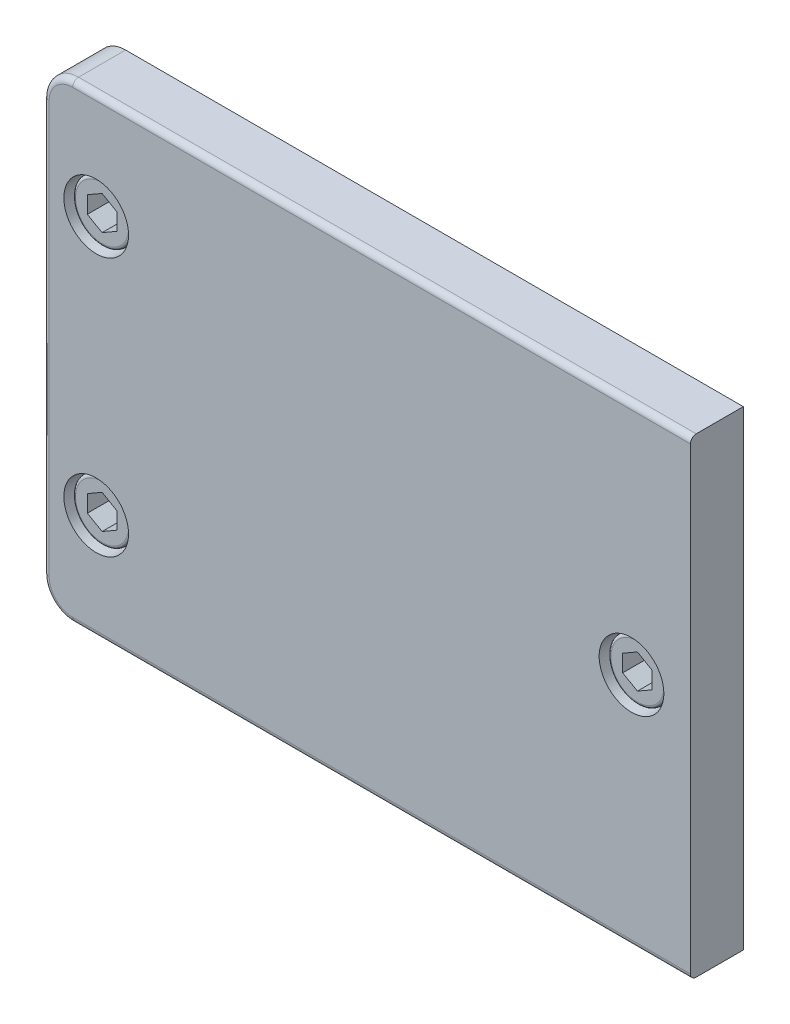
from build123d import *

# Parameters (mm, degrees)
BOSS_EXTRU_1_DEPTH               = 9
CONG_1_R                         = 1
ESQUISSE4_R                      = 5.5
ENL_V_MAT_EXTRU_1_DEPTH          = 7
ESQUISSE5_R                      = 5
BOSS_EXTRU_2_DEPTH               = 6
CONG_2_R                         = 0.5
ENL_V_MAT_EXTRU_2_DEPTH          = 4
R_P_TITION_LIN_AIRE1_COUNT       = 2
R_P_TITION_LIN_AIRE1_PITCH       = 44
CONG_2_OF_R_P_TITION_LIN_AIRE1_R = 0.5
ESQUISSE7_R                      = 5.5
ENL_V_MAT_EXTRU_3_DEPTH          = 7
ESQUISSE8_R                      = 5
BOSS_EXTRU_3_DEPTH               = 6
CONG_3_R                         = 0.5
ENL_V_MAT_EXTRU_4_DEPTH          = 5
ESQUISSE10_R                     = 3
ENL_V_MAT_EXTRU_5_DEPTH          = 5


with BuildPart() as part:
    # Esquisse1 → Boss.-Extru.1 (new body)
    with BuildSketch(Plane(origin=(0, 0, 0), x_dir=(-1, 0, 0), z_dir=(0, 0, 1))):
        with BuildLine():
            Line((0, 5), (0, 75))
            ThreePointArc((0, 75), (-1.464466094, 78.535533906), (-5, 80))
            Line((-5, 80), (-110, 80))
            Line((-110, 80), (-110, 0))
            Line((-110, 0), (-5, 0))
            ThreePointArc((-5, 0), (-1.464466094, 1.464466094), (0, 5))
        make_face()
    extrude(amount=BOSS_EXTRU_1_DEPTH)

    # Congé1
    cong_1_edges = [part.edges().sort_by_distance(p)[0] for p in [
        (1.464466094, -78.535533906, 9),
        (57.5, -80, 9),
        (57.5, 0, 9),
        (1.464466094, -1.464466094, 9),
        (0, -40, 9),
    ]]
    fillet(cong_1_edges, radius=CONG_1_R)

    # Esquisse4 → Enlèv. mat.-Extru.1 (cut)
    with BuildSketch(Plane.XY.offset(9)):
        with Locations((9, -18)):
            Circle(ESQUISSE4_R)
    enl_v_mat_extru_1 = extrude(amount=-ENL_V_MAT_EXTRU_1_DEPTH, mode=Mode.SUBTRACT)

    # Esquisse5 → Boss.-Extru.2 (add)
    with BuildSketch(Plane.XY.offset(2)):
        with Locations((9, -18)):
            Circle(ESQUISSE5_R)
    boss_extru_2 = extrude(amount=BOSS_EXTRU_2_DEPTH)

    # Congé2
    cong_2_edges = [part.edges().sort_by_distance(p)[0] for p in [
        (4, -18, 8),
    ]]
    fillet(cong_2_edges, radius=CONG_2_R)

    # Esquisse6 → Enlèv. mat.-Extru.2 (cut)
    with BuildSketch(Plane.XY.offset(8)):
        Polygon((9, -15.113248654), (6.5, -16.556624327), (6.5, -19.443375673), (9, -20.886751346), (11.5, -19.443375673), (11.5, -16.556624327), align=None)
    enl_v_mat_extru_2 = extrude(amount=-ENL_V_MAT_EXTRU_2_DEPTH, mode=Mode.SUBTRACT)

    # Répétition linéaire1: Enlèv. mat.-Extru.1, Boss.-Extru.2, Enlèv. mat.-Extru.2 ×2
    with Locations(*[(0, -i * R_P_TITION_LIN_AIRE1_PITCH, 0) for i in range(1, R_P_TITION_LIN_AIRE1_COUNT)]):
        add(enl_v_mat_extru_1, mode=Mode.SUBTRACT)
        add(boss_extru_2)
        add(enl_v_mat_extru_2, mode=Mode.SUBTRACT)

    # Congé2 of Répétition linéaire1
    cong_2_of_r_p_tition_lin_aire1_edges = [part.edges().sort_by_distance(p)[0] for p in [
        (4, -62, 8),
    ]]
    fillet(cong_2_of_r_p_tition_lin_aire1_edges, radius=CONG_2_OF_R_P_TITION_LIN_AIRE1_R)

    # Esquisse7 → Enlèv. mat.-Extru.3 (cut)
    with BuildSketch(Plane.XY.offset(9)):
        with Locations((100, -40)):
            Circle(ESQUISSE7_R)
    extrude(amount=-ENL_V_MAT_EXTRU_3_DEPTH, mode=Mode.SUBTRACT)

    # Esquisse8 → Boss.-Extru.3 (add)
    with BuildSketch(Plane.XY.offset(2)):
        with Locations((100, -40)):
            Circle(ESQUISSE8_R)
    extrude(amount=BOSS_EXTRU_3_DEPTH)

    # Congé3
    cong_3_edges = [part.edges().sort_by_distance(p)[0] for p in [
        (95, -40, 8),
    ]]
    fillet(cong_3_edges, radius=CONG_3_R)

    # Esquisse9 → Enlèv. mat.-Extru.4 (cut)
    with BuildSketch(Plane.XY.offset(8)):
        Polygon((100, -37.113248654), (97.5, -38.556624327), (97.5, -41.443375673), (100, -42.886751346), (102.5, -41.443375673), (102.5, -38.556624327), align=None)
    extrude(amount=-ENL_V_MAT_EXTRU_4_DEPTH, mode=Mode.SUBTRACT)

    # Esquisse10 → Enlèv. mat.-Extru.5 (cut)
    with BuildSketch(Plane(origin=(0, 0, 0), x_dir=(-1, 0, 0), z_dir=(0, 0, -1))):
        with Locations((-6, -40)):
            Circle(ESQUISSE10_R)
    extrude(amount=-ENL_V_MAT_EXTRU_5_DEPTH, mode=Mode.SUBTRACT)


solid = part.part
